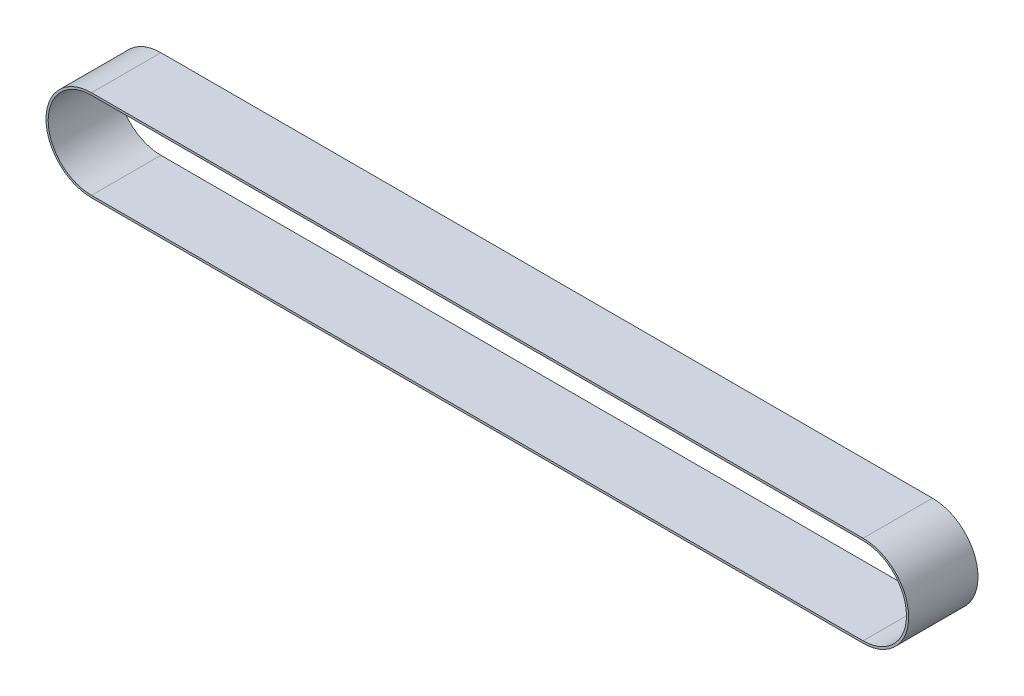
from build123d import *

# Parameters (mm, degrees)
BOSS_EXTRUDE1_DEPTH = 50.8


with BuildPart() as part:
    # Sketch1 → Boss-Extrude1 (new body)
    with BuildSketch(Plane.XY):
        with BuildLine():
            Line((0, 33.3375), (565.15, 33.3375))
            ThreePointArc((565.15, 33.3375), (598.4875, 0), (565.15, -33.3375))
            Line((565.15, -33.3375), (0, -33.3375))
            ThreePointArc((0, -33.3375), (-33.3375, 0), (0, 33.3375))
        make_face()
        with BuildLine():
            Line((0, 31.75), (565.15, 31.75))
            ThreePointArc((565.15, 31.75), (596.9, 0), (565.15, -31.75))
            Line((565.15, -31.75), (0, -31.75))
            ThreePointArc((0, -31.75), (-31.75, 0), (0, 31.75))
        make_face(mode=Mode.SUBTRACT)
    extrude(amount=BOSS_EXTRUDE1_DEPTH)


solid = part.part
